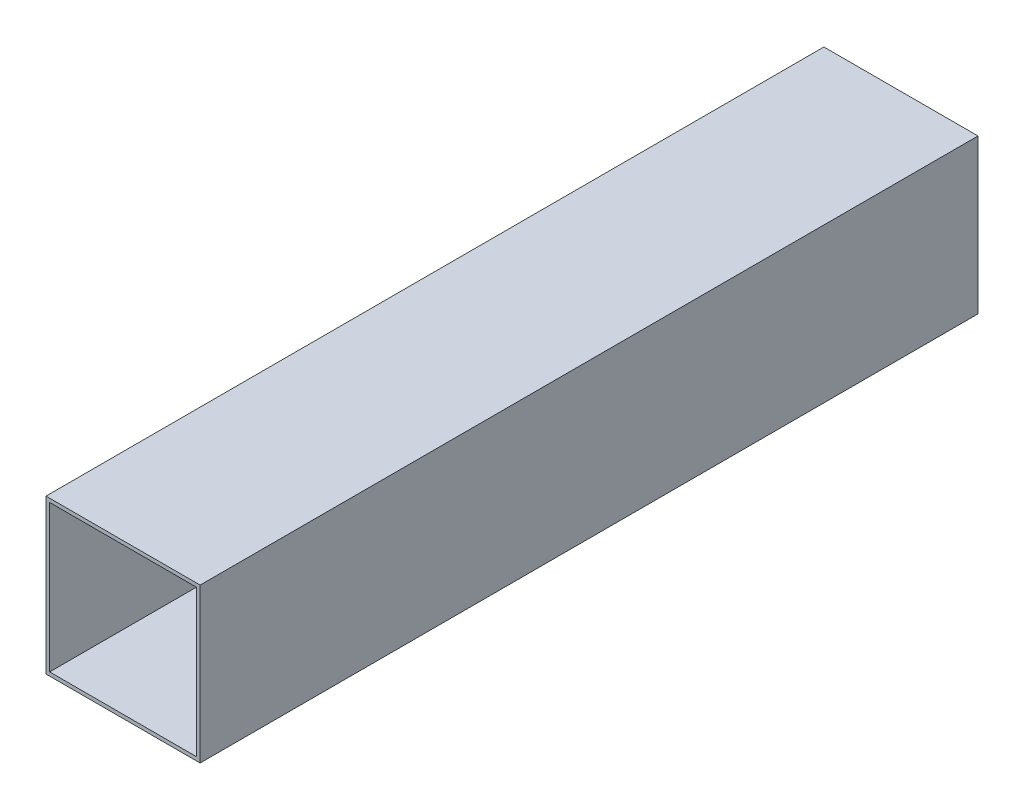
from build123d import *

# Parameters (mm, degrees)
SKETCH2_W           = 105
SKETCH2_H           = 105
SKETCH2_W_2         = 100
SKETCH2_H_2         = 100
BOSS_EXTRUDE1_DEPTH = 530
SKETCH3_W           = 70
SKETCH3_H           = 60
CUT_EXTRUDE1_DEPTH  = 530


with BuildPart() as part:
    # Sketch2 → Boss-Extrude1 (new body)
    with BuildSketch(Plane.XY):
        Rectangle(SKETCH2_W, SKETCH2_H)
        Rectangle(SKETCH2_W_2, SKETCH2_H_2, mode=Mode.SUBTRACT)
    extrude(amount=BOSS_EXTRUDE1_DEPTH)

    # Sketch3 → Cut-Extrude1 (cut)
    with BuildSketch(Plane(origin=(0, 0, 0), x_dir=(1, 0, 0), z_dir=(0, 1, 0))):
        with Locations((0.960794274, -120)):
            Rectangle(SKETCH3_W, SKETCH3_H)
        with Locations((0.960794274, -330)):
            Rectangle(SKETCH3_W, SKETCH3_H)
    extrude(amount=-CUT_EXTRUDE1_DEPTH, mode=Mode.SUBTRACT)


solid = part.part
